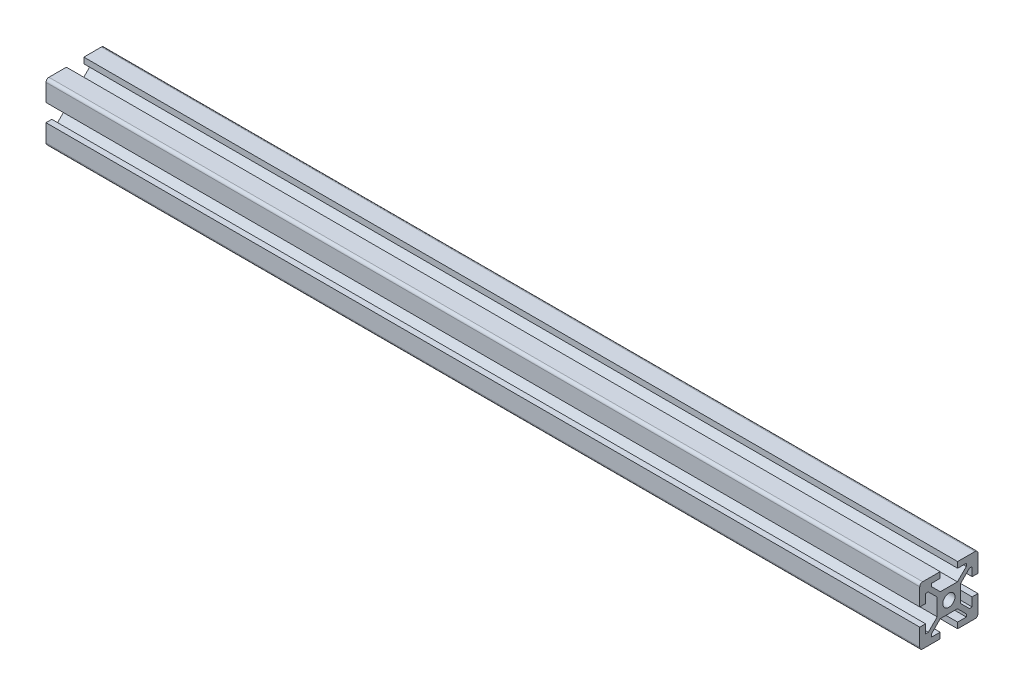
from build123d import *

# Parameters (mm, degrees)
SKETCH1_R           = 2.1
BOSS_EXTRUDE1_DEPTH = 300
SKETCH10_R          = 2.1
BOSS_EXTRUDE4_DEPTH = 15
BOSS_EXTRUDE5_START = -15
SKETCH11_R          = 2.1
BOSS_EXTRUDE5_DEPTH = 15
TAPPED_HOLE3_D      = 4.2
TAPPED_HOLE3_DEPTH  = 15
TAPPED_HOLE4_D      = 4.2


with BuildPart() as part:
    # Sketch1 → Boss-Extrude1 (new body)
    with BuildSketch(Plane(origin=(0, 0, 0), x_dir=(0, 0, -1), z_dir=(1, 0, 0))):
        with BuildLine():
            Line((-10, 9), (-10, 3))
            Line((-10, 3), (-8, 3))
            Line((-8, 3), (-8, 6))
            Line((-8, 6), (-7.060660172, 6))
            Line((-7.060660172, 6), (-4, 2.939339828))
            Line((-4, 2.939339828), (-4, -2.939339828))
            Line((-4, -2.939339828), (-7.060660172, -6))
            Line((-7.060660172, -6), (-8, -6))
            Line((-8, -6), (-8, -3))
            Line((-8, -3), (-10, -3))
            Line((-10, -3), (-10, -9))
            ThreePointArc((-10, -9), (-9.707106781, -9.707106781), (-9, -10))
            Line((-9, -10), (-3, -10))
            Line((-3, -10), (-3, -8))
            Line((-3, -8), (-6, -8))
            Line((-6, -8), (-6, -7.060660172))
            Line((-6, -7.060660172), (-2.939339828, -4))
            Line((-2.939339828, -4), (2.939339828, -4))
            Line((2.939339828, -4), (6, -7.060660172))
            Line((6, -7.060660172), (6, -8))
            Line((6, -8), (3, -8))
            Line((3, -8), (3, -10))
            Line((3, -10), (9, -10))
            ThreePointArc((9, -10), (9.707106781, -9.707106781), (10, -9))
            Line((10, -9), (10, -3))
            Line((10, -3), (8, -3))
            Line((8, -3), (8, -6))
            Line((8, -6), (7.060660172, -6))
            Line((7.060660172, -6), (4, -2.939339828))
            Line((4, -2.939339828), (4, 2.939339828))
            Line((4, 2.939339828), (7.060660172, 6))
            Line((7.060660172, 6), (8, 6))
            Line((8, 6), (8, 3))
            Line((8, 3), (10, 3))
            Line((10, 3), (10, 9))
            ThreePointArc((10, 9), (9.707106781, 9.707106781), (9, 10))
            Line((9, 10), (3, 10))
            Line((3, 10), (3, 8))
            Line((3, 8), (6, 8))
            Line((6, 8), (6, 7.060660172))
            Line((6, 7.060660172), (2.939339828, 4))
            Line((2.939339828, 4), (-2.939339828, 4))
            Line((-2.939339828, 4), (-6, 7.060660172))
            Line((-6, 7.060660172), (-6, 8))
            Line((-6, 8), (-3, 8))
            Line((-3, 8), (-3, 10))
            Line((-3, 10), (-9, 10))
            ThreePointArc((-9, 10), (-9.707106781, 9.707106781), (-10, 9))
        make_face()
        Circle(SKETCH1_R, mode=Mode.SUBTRACT)
    extrude(amount=BOSS_EXTRUDE1_DEPTH)

    # Sketch10 → Boss-Extrude4 (add)
    with BuildSketch(Plane(origin=(0, 0, 0), x_dir=(0, 0, -1), z_dir=(1, 0, 0))):
        Circle(SKETCH10_R)
    extrude(amount=BOSS_EXTRUDE4_DEPTH)

    # Sketch11 → Boss-Extrude5 (add)
    with BuildSketch(Plane(origin=(300, 0, 0), x_dir=(0, 0, -1), z_dir=(1, 0, 0)).offset(BOSS_EXTRUDE5_START)):
        Circle(SKETCH11_R)
    extrude(amount=BOSS_EXTRUDE5_DEPTH)

    # Tapped Hole3
    with Locations(Plane(origin=(0, 0, 24.134534173), x_dir=(0, 0, -1), z_dir=(-1, 0, 0))):
        with Locations((24.134534173, 0)):
            Hole(TAPPED_HOLE3_D / 2, depth=TAPPED_HOLE3_DEPTH)

    # Tapped Hole4 (through all)
    with Locations(Plane(origin=(300, 0, -78.156137256), x_dir=(0, 0, 1), z_dir=(1, 0, 0))):
        with Locations((78.156137256, 0)):
            Hole(TAPPED_HOLE4_D / 2)


solid = part.part
